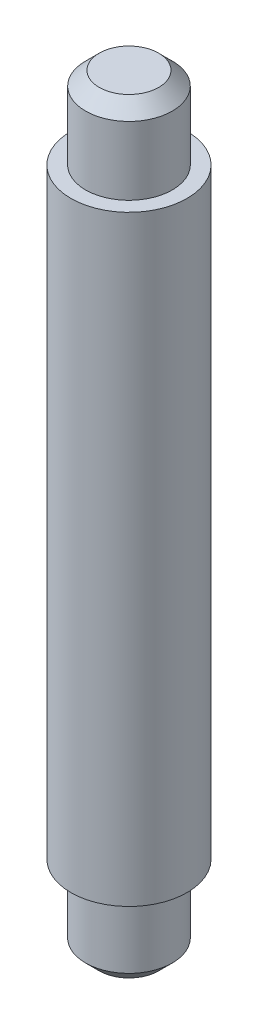
from build123d import *

# Parameters (mm, degrees)
SKETCH5_R            = 3.175
BOSS_EXTRUDE10_DEPTH = 56
BOSS_EXTRUDE11_START = 6
SKETCH5_3_R          = 4.25
SKETCH5_3_R_2        = 3.175
BOSS_EXTRUDE11_DEPTH = 44
CHAMFER4_SIZE        = 1


with BuildPart() as part:
    # Sketch5 → Boss-Extrude10 (new body)
    with BuildSketch(Plane(origin=(0, 0, 0), x_dir=(1, 0, 0), z_dir=(0, 1, 0))):
        Circle(SKETCH5_R)
    extrude(amount=BOSS_EXTRUDE10_DEPTH)

    # Sketch5<3> → Boss-Extrude11 (add)
    with BuildSketch(Plane(origin=(0, 0, 0), x_dir=(1, 0, 0), z_dir=(0, 1, 0)).offset(BOSS_EXTRUDE11_START)):
        Circle(SKETCH5_3_R)
        Circle(SKETCH5_3_R_2, mode=Mode.SUBTRACT)
    extrude(amount=BOSS_EXTRUDE11_DEPTH)

    # Chamfer4
    chamfer4_edges = [part.edges().sort_by_distance(p)[0] for p in [
        (-3.175, 0, 0),
        (-3.175, 56, 0),
    ]]
    chamfer(chamfer4_edges, length=CHAMFER4_SIZE)


solid = part.part
